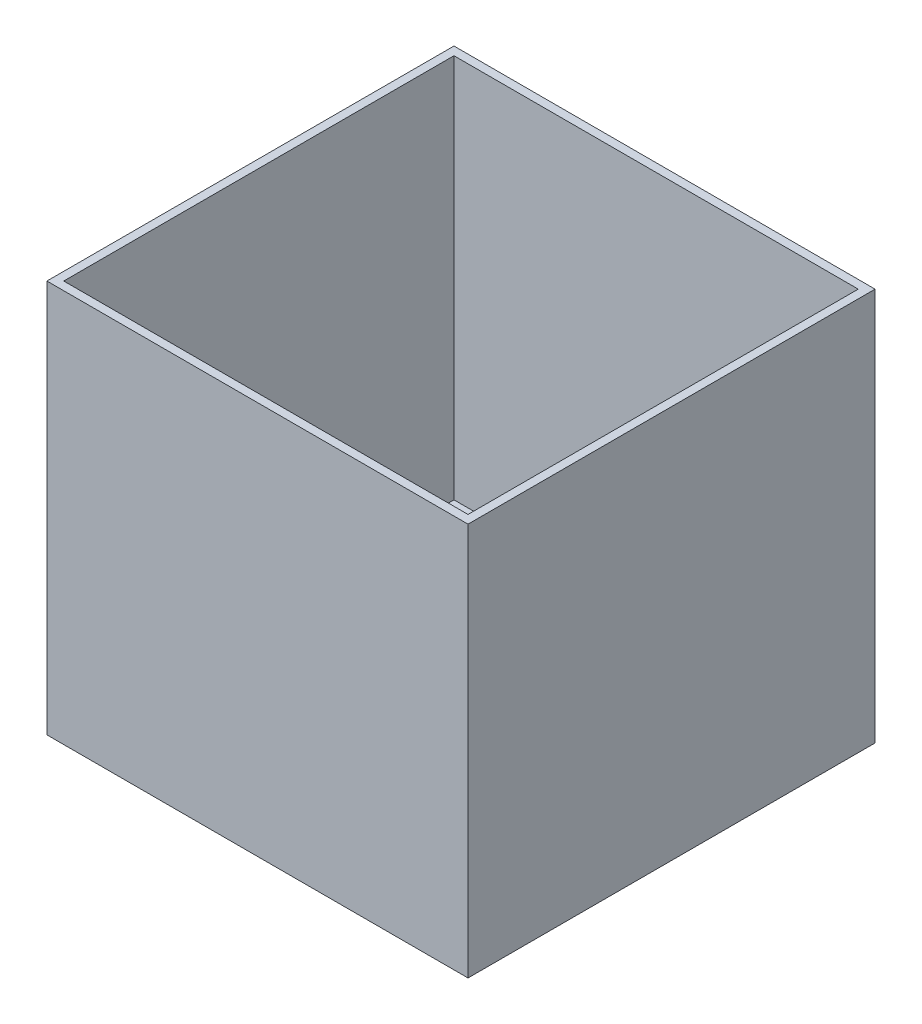
from build123d import *

# Parameters (mm, degrees)
SKETCH2_W           = 150
SKETCH2_H           = 145
BOSS_EXTRUDE2_DEPTH = 140
SHELL1_T            = 3
SKETCH4_W           = 144
SKETCH4_H           = 139
CUT_EXTRUDE3_DEPTH  = 5


with BuildPart() as part:
    # Sketch2 → Boss-Extrude2 (new body)
    with BuildSketch(Plane(origin=(0, 0, 0), x_dir=(1, 0, 0), z_dir=(0, 1, 0))):
        Rectangle(SKETCH2_W, SKETCH2_H)
    extrude(amount=BOSS_EXTRUDE2_DEPTH)

    # Shell1 (no face opened: a closed hollow body)
    add(offset(amount=-SHELL1_T, mode=Mode.PRIVATE), mode=Mode.SUBTRACT)

    # Sketch4 → Cut-Extrude3 (cut)
    with BuildSketch(Plane(origin=(0, 140, 0), x_dir=(1, 0, 0), z_dir=(0, 1, 0))):
        Rectangle(SKETCH4_W, SKETCH4_H)
    extrude(amount=-CUT_EXTRUDE3_DEPTH, mode=Mode.SUBTRACT)


solid = part.part
